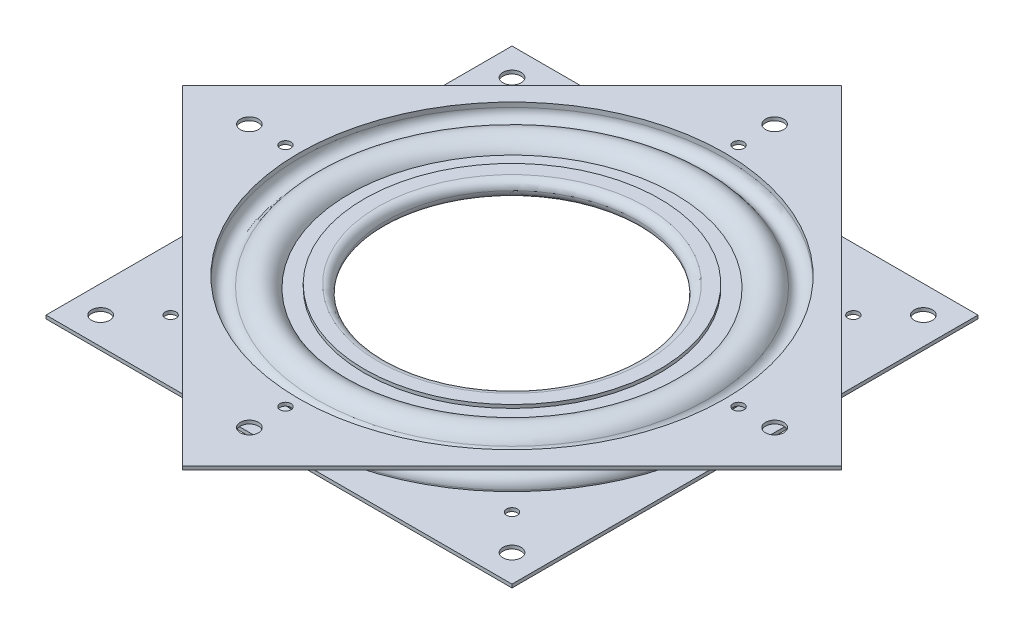
from build123d import *

# Parameters (mm, degrees)
SKETCH2_W                                 = 101.6
SKETCH2_H                                 = 101.6
SKETCH2_R                                 = 46.427290861
EXTRUDE1_DEPTH                            = 0.7366
EXTRUDE2_START                            = -0.7366
SKETCH3_R                                 = 46.427290861
EXTRUDE2_DEPTH                            = 0.7366
CIRPATTERN1_COUNT                         = 4
SKETCH5_W                                 = 1.984375
SKETCH5_H                                 = 0.7366
F_5_32_0_156250_DIAMETER_HOLE1_AT_2_COUNT = 2
F_5_32_0_156250_DIAMETER_HOLE1_AT_2_PITCH = 89.6874
F_5_32_0_156250_DIAMETER_HOLE1_AT_3_COUNT = 2
F_5_32_0_156250_DIAMETER_HOLE1_AT_3_PITCH = 89.6874
F_5_32_0_156250_DIAMETER_HOLE1_AT_4_COUNT = 2
F_5_32_0_156250_DIAMETER_HOLE1_AT_4_PITCH = 126.837137454
SKETCH7_W                                 = 1.984375
SKETCH7_H                                 = 8.128
F_5_32_0_156250_DIAMETER_HOLE2_AT_2_COUNT = 2
F_5_32_0_156250_DIAMETER_HOLE2_AT_2_PITCH = 80.9752
F_5_32_0_156250_DIAMETER_HOLE2_AT_3_COUNT = 2
F_5_32_0_156250_DIAMETER_HOLE2_AT_3_PITCH = 114.516226056
F_5_32_0_156250_DIAMETER_HOLE2_AT_4_COUNT = 2
F_5_32_0_156250_DIAMETER_HOLE2_AT_4_PITCH = 80.9752
SKETCH9_W                                 = 1.190625
SKETCH9_H                                 = 0.7366
F_3_32_0_093750_DIAMETER_HOLE1_AT_2_COUNT = 2
F_3_32_0_093750_DIAMETER_HOLE1_AT_2_PITCH = 69.85
F_3_32_0_093750_DIAMETER_HOLE1_AT_3_COUNT = 2
F_3_32_0_093750_DIAMETER_HOLE1_AT_3_PITCH = 98.782817332
F_3_32_0_093750_DIAMETER_HOLE1_AT_4_COUNT = 2
F_3_32_0_093750_DIAMETER_HOLE1_AT_4_PITCH = 69.85
F_3_32_0_093750_DIAMETER_HOLE2_AT_2_COUNT = 2
F_3_32_0_093750_DIAMETER_HOLE2_AT_2_PITCH = 74.422
F_3_32_0_093750_DIAMETER_HOLE2_AT_3_COUNT = 2
F_3_32_0_093750_DIAMETER_HOLE2_AT_3_PITCH = 105.248601739
F_3_32_0_093750_DIAMETER_HOLE2_AT_4_COUNT = 2
F_3_32_0_093750_DIAMETER_HOLE2_AT_4_PITCH = 74.422


with BuildPart() as part:
    # Sketch1 → Revolve-Thin4 (revolve)
    with BuildSketch(Plane.XY, mode=Mode.PRIVATE) as revolve_thin4_sk:
        with BuildLine():
            Line((32.19552446, 1.778), (29.21, 1.778))
            ThreePointArc((29.21, 1.778), (27.432, 0), (29.21, -1.778))
            Line((29.21, -1.778), (35.18104892, -1.778))
            ThreePointArc((35.18104892, -1.778), (38.567175582, -4.788771381), (42.635527241, -2.794))
            ThreePointArc((42.635527241, -2.794), (44.921211161, -1.847238721), (46.427290861, -3.81))
            Line((46.427290861, -3.81), (46.427290861, -4.826))
            Line((46.427290861, -4.826), (50.8, -4.826))
            Line((50.8, -4.826), (50.8, -4.0894))
            Line((50.8, -4.0894), (47.163890861, -4.0894))
            Line((47.163890861, -4.0894), (47.163890861, -3.81))
            ThreePointArc((47.163890861, -3.81), (45.11185727, -1.135737757), (41.997612929, -2.4257))
            ThreePointArc((41.997612929, -2.4257), (38.390625346, -4.00937161), (35.800351285, -1.0414))
            Line((35.800351285, -1.0414), (29.21, -1.0414))
            ThreePointArc((29.21, -1.0414), (28.1686, 0), (29.21, 1.0414))
            Line((29.21, 1.0414), (32.19552446, 1.0414))
            Line((32.19552446, 1.0414), (32.19552446, 1.778))
        make_face()
    revolve(revolve_thin4_sk.sketch.rotate(Axis((0, 21.71272626, 0), (0, -1, 0)), 90), axis=Axis((0, 21.71272626, 0), (0, -1, 0)))

    # Sketch2 → Extrude1 (add)
    with BuildSketch(Plane.XZ.offset(4.826)):
        Rectangle(SKETCH2_W, SKETCH2_H)
        with Locations(Location((0, 0, 0), (0, 0, 90))):
            Circle(SKETCH2_R, mode=Mode.SUBTRACT)
    extrude(amount=-EXTRUDE1_DEPTH)

    # Sketch5 → 5/32 (0.156250) Diameter Hole1 (revolve, cut)
    with BuildSketch(Plane(origin=(44.8437, -4.0894, -44.8437), x_dir=(0, 0, 1), z_dir=(1, 0, 0))):
        with Locations((0.9921875, 0.3683)):
            Rectangle(SKETCH5_W, SKETCH5_H)
    f_5_32_0_156250_diameter_hole1 = revolve(axis=Axis((44.8437, 2.2606, -44.8437), (0, -1, 0)), mode=Mode.SUBTRACT)

    # 5/32 (0.156250) Diameter Hole1 at 2: 5/32 (0.156250) Diameter Hole1 ×2
    with Locations(*[(0, 0, i * F_5_32_0_156250_DIAMETER_HOLE1_AT_2_PITCH) for i in range(1, F_5_32_0_156250_DIAMETER_HOLE1_AT_2_COUNT)]):
        add(f_5_32_0_156250_diameter_hole1, mode=Mode.SUBTRACT)

    # 5/32 (0.156250) Diameter Hole1 at 3: 5/32 (0.156250) Diameter Hole1 ×2
    with Locations(*[(-i * F_5_32_0_156250_DIAMETER_HOLE1_AT_3_PITCH, 0, 0) for i in range(1, F_5_32_0_156250_DIAMETER_HOLE1_AT_3_COUNT)]):
        add(f_5_32_0_156250_diameter_hole1, mode=Mode.SUBTRACT)

    # 5/32 (0.156250) Diameter Hole1 at 4: 5/32 (0.156250) Diameter Hole1 ×2
    with Locations(*[Vector(-0.7071067811865476, 0, 0.7071067811865476) * (i * F_5_32_0_156250_DIAMETER_HOLE1_AT_4_PITCH) for i in range(1, F_5_32_0_156250_DIAMETER_HOLE1_AT_4_COUNT)]):
        add(f_5_32_0_156250_diameter_hole1, mode=Mode.SUBTRACT)

    # Sketch11 → 3/32 (0.093750) Diameter Hole2 (revolve, cut)
    with BuildSketch(Plane(origin=(37.211, -4.0894, 37.211), x_dir=(0, 0, 1), z_dir=(1, 0, 0))):
        Polygon((0, 0), (0, 26.115399675), (1.190625, 25.4), (1.190625, 0), align=None)
    f_3_32_0_093750_diameter_hole2 = revolve(axis=Axis((37.211, 2.2606, 37.211), (0, -1, 0)), mode=Mode.SUBTRACT)

    # 3/32 (0.093750) Diameter Hole2 at 2: 3/32 (0.093750) Diameter Hole2 ×2
    with Locations(*[(-i * F_3_32_0_093750_DIAMETER_HOLE2_AT_2_PITCH, 0, 0) for i in range(1, F_3_32_0_093750_DIAMETER_HOLE2_AT_2_COUNT)]):
        add(f_3_32_0_093750_diameter_hole2, mode=Mode.SUBTRACT)

    # 3/32 (0.093750) Diameter Hole2 at 3: 3/32 (0.093750) Diameter Hole2 ×2
    with Locations(*[Vector(-0.7071067811865476, 0, -0.7071067811865476) * (i * F_3_32_0_093750_DIAMETER_HOLE2_AT_3_PITCH) for i in range(1, F_3_32_0_093750_DIAMETER_HOLE2_AT_3_COUNT)]):
        add(f_3_32_0_093750_diameter_hole2, mode=Mode.SUBTRACT)

    # 3/32 (0.093750) Diameter Hole2 at 4: 3/32 (0.093750) Diameter Hole2 ×2
    with Locations(*[(0, 0, -i * F_3_32_0_093750_DIAMETER_HOLE2_AT_4_PITCH) for i in range(1, F_3_32_0_093750_DIAMETER_HOLE2_AT_4_COUNT)]):
        add(f_3_32_0_093750_diameter_hole2, mode=Mode.SUBTRACT)


with BuildPart() as body_2:
    # Sketch1<5> → Revolve-Thin5 (revolve)
    with BuildSketch(Plane.XY, mode=Mode.PRIVATE) as revolve_thin5_sk:
        with BuildLine():
            Line((29.21, 1.0414), (35.474043872, 1.0414))
            ThreePointArc((35.474043872, 1.0414), (38.986340067, 3.299931105), (42.635527241, 1.27))
            ThreePointArc((42.635527241, 1.27), (44.921211161, 0.323238721), (46.427290861, 2.286))
            Line((46.427290861, 2.286), (46.427290861, 3.302))
            Line((46.427290861, 3.302), (50.8, 3.302))
            Line((50.8, 3.302), (50.8, 2.5654))
            Line((50.8, 2.5654), (47.163890861, 2.5654))
            Line((47.163890861, 2.5654), (47.163890861, 2.286))
            ThreePointArc((47.163890861, 2.286), (45.11185727, -0.388262243), (41.997612929, 0.9017))
            ThreePointArc((41.997612929, 0.9017), (38.788408911, 2.54923464), (35.964249927, 0.3048))
            Line((35.964249927, 0.3048), (29.21, 0.3048))
            Line((29.21, 0.3048), (29.21, 1.0414))
        make_face()
    revolve(revolve_thin5_sk.sketch.rotate(Axis((0, 21.71272626, 0), (0, -1, 0)), 90), axis=Axis((0, 21.71272626, 0), (0, -1, 0)))

    # Sketch3 → Extrude2 (add)
    with BuildSketch(Plane(origin=(0, 3.302, 0), x_dir=(-1, 0, 0), z_dir=(0, 1, 0)).offset(EXTRUDE2_START)):
        Polygon((0, -71.842048969), (71.842048969, 0), (0, 71.842048969), (-71.842048969, 0), align=None)
        with Locations(Location((0, 0, 0), (0, 0, 90))):
            Circle(SKETCH3_R, mode=Mode.SUBTRACT)
    extrude(amount=EXTRUDE2_DEPTH)

    # Sketch7 → 5/32 (0.156250) Diameter Hole2 (revolve, cut)
    with BuildSketch(Plane(origin=(57.258113028, 3.302, 0), x_dir=(0, 0, 1), z_dir=(1, 0, 0))):
        with Locations((0.9921875, 4.064)):
            Rectangle(SKETCH7_W, SKETCH7_H)
    f_5_32_0_156250_diameter_hole2 = revolve(axis=Axis((57.258113028, 9.652, 0), (0, -1, 0)), mode=Mode.SUBTRACT)

    # 5/32 (0.156250) Diameter Hole2 at 2: 5/32 (0.156250) Diameter Hole2 ×2
    with Locations(*[Vector(-0.7071067811865475, 0, -0.7071067811865476) * (i * F_5_32_0_156250_DIAMETER_HOLE2_AT_2_PITCH) for i in range(1, F_5_32_0_156250_DIAMETER_HOLE2_AT_2_COUNT)]):
        add(f_5_32_0_156250_diameter_hole2, mode=Mode.SUBTRACT)

    # 5/32 (0.156250) Diameter Hole2 at 3: 5/32 (0.156250) Diameter Hole2 ×2
    with Locations(*[(-i * F_5_32_0_156250_DIAMETER_HOLE2_AT_3_PITCH, 0, 0) for i in range(1, F_5_32_0_156250_DIAMETER_HOLE2_AT_3_COUNT)]):
        add(f_5_32_0_156250_diameter_hole2, mode=Mode.SUBTRACT)

    # 5/32 (0.156250) Diameter Hole2 at 4: 5/32 (0.156250) Diameter Hole2 ×2
    with Locations(*[Vector(-0.7071067811865475, 0, 0.7071067811865476) * (i * F_5_32_0_156250_DIAMETER_HOLE2_AT_4_PITCH) for i in range(1, F_5_32_0_156250_DIAMETER_HOLE2_AT_4_COUNT)]):
        add(f_5_32_0_156250_diameter_hole2, mode=Mode.SUBTRACT)

    # Sketch9 → 3/32 (0.093750) Diameter Hole1 (revolve, cut)
    with BuildSketch(Plane(origin=(0, 3.302, -49.391408666), x_dir=(0, 0, 1), z_dir=(1, 0, 0))):
        with Locations((0.5953125, 0.3683)):
            Rectangle(SKETCH9_W, SKETCH9_H)
    f_3_32_0_093750_diameter_hole1 = revolve(axis=Axis((0, 9.652, -49.391408666), (0, -1, 0)), mode=Mode.SUBTRACT)

    # 3/32 (0.093750) Diameter Hole1 at 2: 3/32 (0.093750) Diameter Hole1 ×2
    with Locations(*[Vector(0.7071067811865477, 0, 0.7071067811865475) * (i * F_3_32_0_093750_DIAMETER_HOLE1_AT_2_PITCH) for i in range(1, F_3_32_0_093750_DIAMETER_HOLE1_AT_2_COUNT)]):
        add(f_3_32_0_093750_diameter_hole1, mode=Mode.SUBTRACT)

    # 3/32 (0.093750) Diameter Hole1 at 3: 3/32 (0.093750) Diameter Hole1 ×2
    with Locations(*[(0, 0, i * F_3_32_0_093750_DIAMETER_HOLE1_AT_3_PITCH) for i in range(1, F_3_32_0_093750_DIAMETER_HOLE1_AT_3_COUNT)]):
        add(f_3_32_0_093750_diameter_hole1, mode=Mode.SUBTRACT)

    # 3/32 (0.093750) Diameter Hole1 at 4: 3/32 (0.093750) Diameter Hole1 ×2
    with Locations(*[Vector(-0.7071067811865474, 0, 0.7071067811865477) * (i * F_3_32_0_093750_DIAMETER_HOLE1_AT_4_PITCH) for i in range(1, F_3_32_0_093750_DIAMETER_HOLE1_AT_4_COUNT)]):
        add(f_3_32_0_093750_diameter_hole1, mode=Mode.SUBTRACT)


with BuildPart() as body_3:
    # Sketch4 → Revolve1 (revolve)
    with BuildSketch(Plane.XY):
        with BuildLine():
            Line((39.116, 2.5146), (39.116, -4.0386))
            ThreePointArc((39.116, -4.0386), (42.3926, -0.762), (39.116, 2.5146))
        make_face()
    revolve(axis=Axis((39.116, 2.837450101, 0), (0, -1, 0)))


with BuildPart() as cirpattern1_1:
    # CirPattern1: pattern copy
    add(body_3.part.rotate(Axis((0, 0, 0), (0, 1, 0)), 1 * 360 / CIRPATTERN1_COUNT))


with BuildPart() as cirpattern1_2:
    # CirPattern1: pattern copy
    add(body_3.part.rotate(Axis((0, 0, 0), (0, 1, 0)), 2 * 360 / CIRPATTERN1_COUNT))


with BuildPart() as cirpattern1_3:
    # CirPattern1: pattern copy
    add(body_3.part.rotate(Axis((0, 0, 0), (0, 1, 0)), 3 * 360 / CIRPATTERN1_COUNT))


solid = Compound([part.part, body_2.part, body_3.part, cirpattern1_1.part, cirpattern1_2.part, cirpattern1_3.part])
